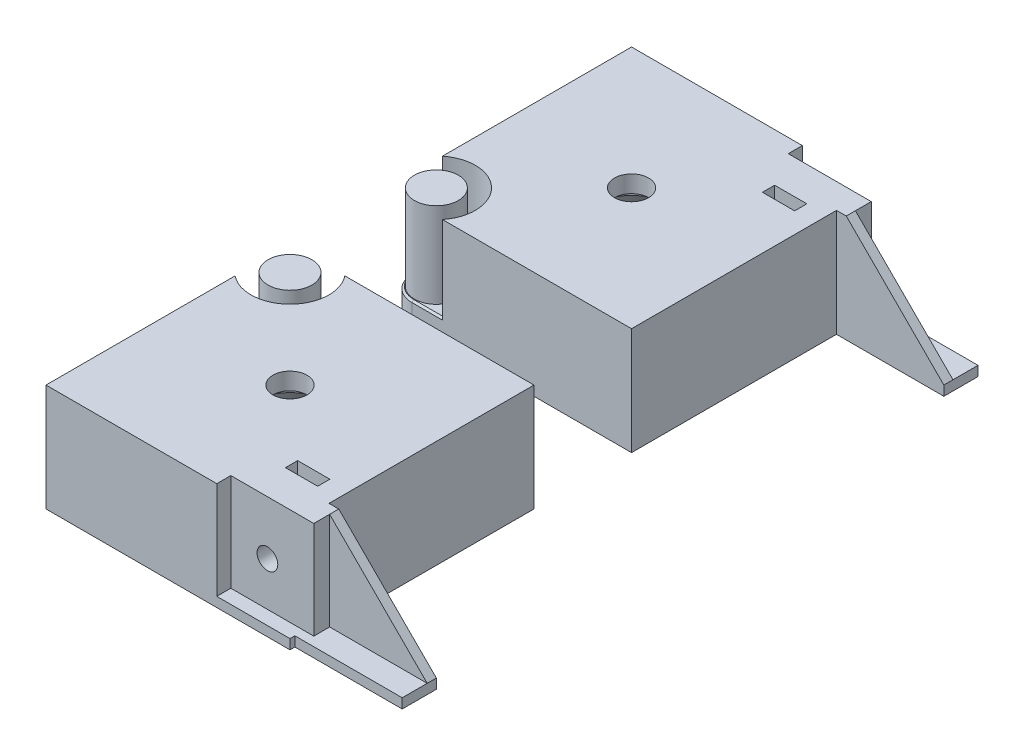
from build123d import *

# Parameters (mm, degrees)
BOSS_EXTRUDE1_DEPTH      = 11
BOSS_EXTRUDE1_DEPTH_BACK = 11
BOSS_EXTRUDE2_DEPTH      = 22
CUT_EXTRUDE1_DEPTH       = 7
SKETCH5_W                = 2
SKETCH5_H                = 3.25
BOSS_EXTRUDE3_DEPTH      = 20
SKETCH6_W                = 37
SKETCH6_H                = 2.875
CUT_EXTRUDE2_DEPTH       = 20
SKETCH8_R                = 2.125
CUT_EXTRUDE3_DEPTH       = 6
SKETCH9_W                = 6.6
SKETCH9_H                = 2.5
CUT_EXTRUDE4_DEPTH       = 14.4
SKETCH11_R               = 2
CUT_EXTRUDE5_DEPTH       = 8
SKETCH12_R               = 8
SKETCH12_R_2             = 4.5
CUT_EXTRUDE6_DEPTH       = 17.5
CHAMFER1_SIZE            = 0.36


with BuildPart() as part:
    # Sketch1 → Boss-Extrude1 (new, two sides: drawn at the far end of the back side and taken through both)
    with BuildSketch(Plane(origin=(0, 0, 0), x_dir=(1, 0, 0), z_dir=(0, 1, 0)).offset(-BOSS_EXTRUDE1_DEPTH_BACK)):
        with BuildLine():
            Line((-20, 25), (25, 25))
            Line((25, 25), (25, -25))
            Line((25, -25), (-25, -25))
            Line((-25, -25), (-25, 20))
            ThreePointArc((-25, 20), (-23.535533906, 23.535533906), (-20, 25))
        make_face()
    extrude(amount=BOSS_EXTRUDE1_DEPTH + BOSS_EXTRUDE1_DEPTH_BACK)

    # Sketch2 → Cut-Revolve1 (revolve, cut)
    with BuildSketch(Plane.XY):
        Polygon((-3.5, 7.5), (-3.5, 11), (0, 11), (0, -11), (-18, -11), (-10.5, 4), (-8, 4), (-8, 7.5), align=None)
    revolve(axis=Axis((0, 11, 0), (0, -1, 0)), mode=Mode.SUBTRACT)

    # Sketch3 → Boss-Extrude2 (add)
    with BuildSketch(Plane(origin=(25, 0, 0), x_dir=(0, 0, -1), z_dir=(1, 0, 0))):
        Polygon((-24, 11), (-22.125, 11), (-22.125, -9), (-18.875, -9), (-18.875, 11), (-17, 11), (-17, -11), (-24, -11), align=None)
    extrude(amount=BOSS_EXTRUDE2_DEPTH)

    # Sketch4 → Cut-Extrude1 (cut)
    with BuildSketch(Plane(origin=(0, 0, 17), x_dir=(-1, 0, 0), z_dir=(0, 0, -1))):
        Polygon((-47, -9), (-27, 11), (-47, 11), align=None)
    extrude(amount=-CUT_EXTRUDE1_DEPTH, mode=Mode.SUBTRACT)

    # Sketch5 → Boss-Extrude3 (add)
    with BuildSketch(Plane(origin=(0, -9, 0), x_dir=(1, 0, 0), z_dir=(0, 1, 0))):
        with Locations((26, -20.5)):
            Rectangle(SKETCH5_W, SKETCH5_H)
    extrude(amount=BOSS_EXTRUDE3_DEPTH)

    # Sketch6 → Cut-Extrude2 (cut)
    with BuildSketch(Plane(origin=(0, 11, 0), x_dir=(1, 0, 0), z_dir=(0, 1, 0))):
        with Locations((28.5, -23.5625)):
            Rectangle(SKETCH6_W, SKETCH6_H)
    extrude(amount=-CUT_EXTRUDE2_DEPTH, mode=Mode.SUBTRACT)

    # Sketch8 → Cut-Extrude3 (cut)
    with BuildSketch(Plane.XY.offset(22.125)):
        with Locations((17.5, 0)):
            Circle(SKETCH8_R)
    extrude(amount=-CUT_EXTRUDE3_DEPTH, mode=Mode.SUBTRACT)

    # Sketch9 → Cut-Extrude4 (cut)
    with BuildSketch(Plane(origin=(0, 11, 0), x_dir=(1, 0, 0), z_dir=(0, 1, 0))):
        with Locations((17.5, -13.875)):
            Rectangle(SKETCH9_W, SKETCH9_H)
    extrude(amount=-CUT_EXTRUDE4_DEPTH, mode=Mode.SUBTRACT)

    # Sketch11 → Cut-Extrude5 (cut)
    with BuildSketch(Plane.XY.offset(16.125)):
        with Locations((17.5, 0)):
            Circle(SKETCH11_R)
    extrude(amount=-CUT_EXTRUDE5_DEPTH, mode=Mode.SUBTRACT)

    # Sketch12 → Cut-Extrude6 (cut)
    with BuildSketch(Plane(origin=(0, 11, 0), x_dir=(1, 0, 0), z_dir=(0, 1, 0))):
        with Locations((-20, 20)):
            Circle(SKETCH12_R)
        with Locations(Location((-20, 20, 0), (0, 0, 270))):
            Circle(SKETCH12_R_2, mode=Mode.SUBTRACT)
    extrude(amount=-CUT_EXTRUDE6_DEPTH, mode=Mode.SUBTRACT)

    # Chamfer1
    chamfer1_edges = [part.edges().sort_by_distance(p)[0] for p in [
        (-16.877501001, -6.5, -25),
        (-25, -6.5, -16.877501001),
        (-23.535533906, -6.5, -23.535533906),
    ]]
    chamfer(chamfer1_edges, length=CHAMFER1_SIZE)


with BuildPart() as body_2:
    # Mirror2: mirrored copy
    add(part.part.mirror(Plane(origin=(0, 0, -35), x_dir=(1, 0, 0), z_dir=(0, 0, -1))))


solid = Compound([part.part, body_2.part])
